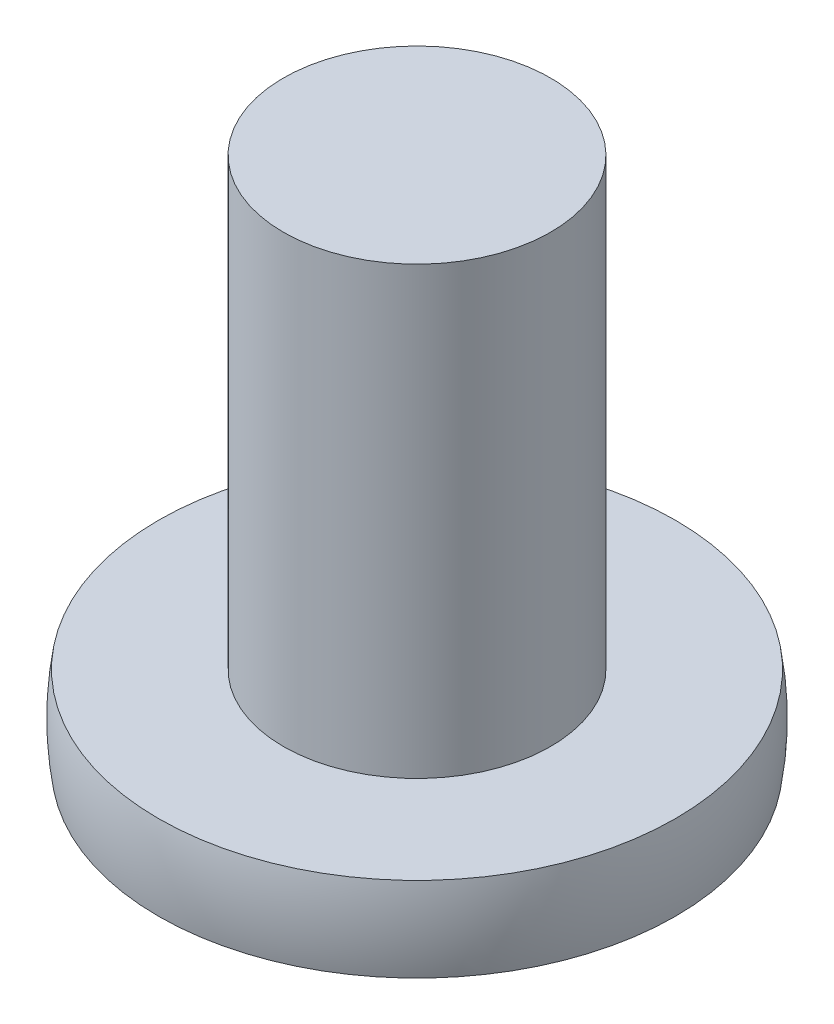
from build123d import *

# Parameters (mm, degrees)
SKETCH_1_R          = 1.5
EXTRUDE_1_DEPTH     = 2
SKETCH_2_R          = 2.95
EXTRUDE_2_DEPTH     = 0.95
CUT_EXTRUDE_1_DEPTH = 1
SKETCH_1_8_R        = 1.5
EXTRUDE_5_DEPTH     = 5


with BuildPart() as part:
    # 草图1 → 拉伸1 (new body)
    with BuildSketch(Plane(origin=(0, 0, 0), x_dir=(1, 0, 0), z_dir=(0, 1, 0))):
        Circle(SKETCH_1_R)
    extrude(amount=EXTRUDE_1_DEPTH)

    # 草图2 → Extrude 2 (add)
    with BuildSketch(Plane(origin=(0, 0, 0), x_dir=(-1, 0, 0), z_dir=(0, 1, 0))):
        Circle(SKETCH_2_R)
    extrude(amount=-EXTRUDE_2_DEPTH)

    # 草图4 → 切除-旋转1 (revolve, cut)
    with BuildSketch(Plane(origin=(0, 0, 0), x_dir=(0, 0, -1), z_dir=(1, 0, 0))):
        with BuildLine():
            Line((-2.901374674, 0), (-2.95, 0))
            Line((-2.95, 0), (-2.95, -0.95))
            Line((-2.95, -0.95), (-2.901374674, -0.95))
            ThreePointArc((-2.901374674, -0.95), (-2.94, -0.475), (-2.901374674, 0))
        make_face()
    revolve(axis=Axis((0, 3.165730861, 0), (0, -1, 0)), mode=Mode.SUBTRACT)

    # 草图3 → 切除-拉伸1 (cut)
    with BuildSketch(Plane.XZ.offset(0.95)):
        Polygon((-1.177794549, 0), (-0.588897275, -1.02), (0.588897275, -1.02), (1.177794549, 0), (0.588897275, 1.02), (-0.588897275, 1.02), align=None)
    extrude(amount=-CUT_EXTRUDE_1_DEPTH, mode=Mode.SUBTRACT)

    # 草图1<8> → 凸台-拉伸5 (add)
    with BuildSketch(Plane(origin=(0, 0, 0), x_dir=(1, 0, 0), z_dir=(0, 1, 0))):
        Circle(SKETCH_1_8_R)
    extrude(amount=EXTRUDE_5_DEPTH)


solid = part.part
